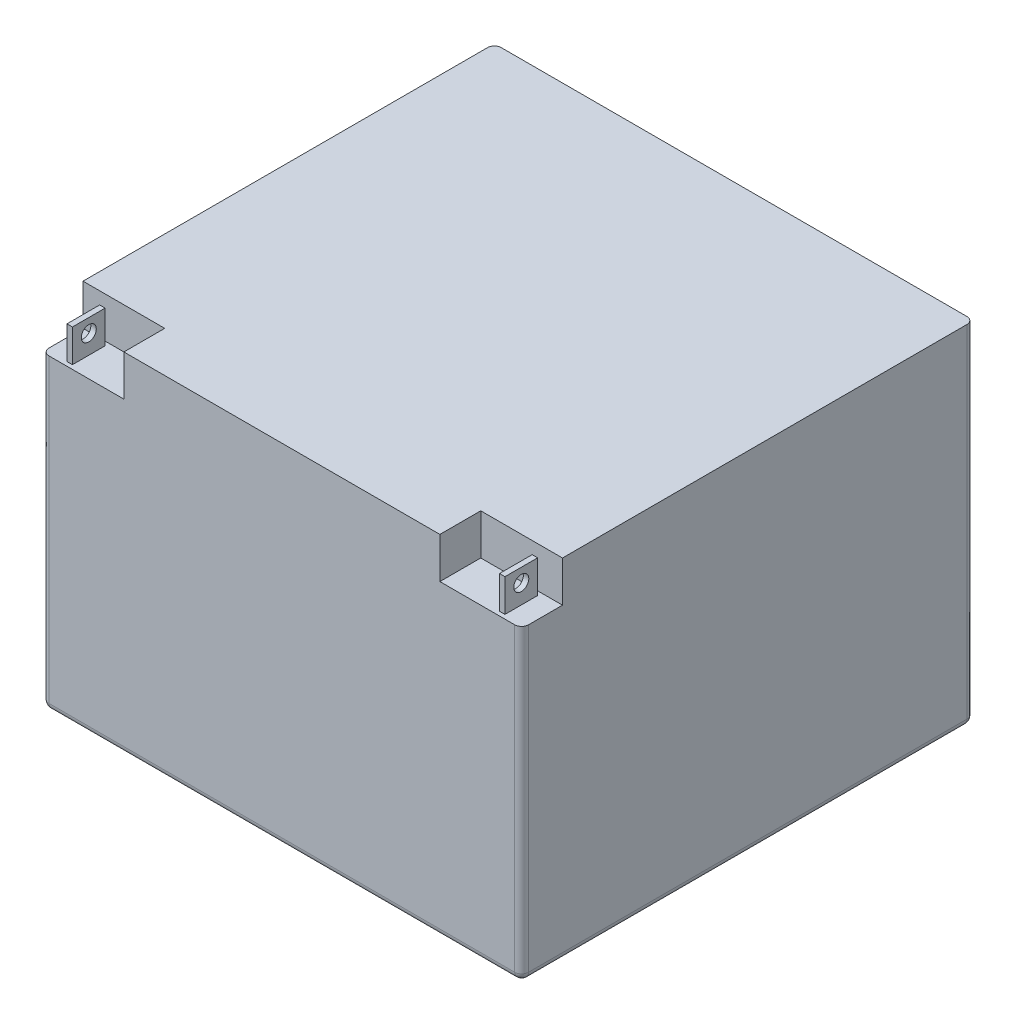
from build123d import *

# Parameters (mm, degrees)
SKETCH1_W           = 176
SKETCH1_H           = 166
BOSS_EXTRUDE1_DEPTH = 128
SKETCH3_W           = 30
SKETCH3_H           = 15
CUT_EXTRUDE1_DEPTH  = 15
FILLET1_R           = 2.54
SKETCH4_W           = 12
SKETCH4_H           = 12
SKETCH4_R           = 2.75
BOSS_EXTRUDE2_DEPTH = 2


with BuildPart() as part:
    # Sketch1 → Boss-Extrude1 (new body)
    with BuildSketch(Plane(origin=(0, 0, 0), x_dir=(1, 0, 0), z_dir=(0, 1, 0))):
        with Locations((0, 83)):
            Rectangle(SKETCH1_W, SKETCH1_H)
    extrude(amount=BOSS_EXTRUDE1_DEPTH)

    # Sketch3 → Cut-Extrude1 (cut)
    with BuildSketch(Plane(origin=(0, 128, 0), x_dir=(1, 0, 0), z_dir=(0, 1, 0))):
        with Locations((73, 7.5)):
            Rectangle(SKETCH3_W, SKETCH3_H)
    cut_extrude1 = extrude(amount=-CUT_EXTRUDE1_DEPTH, mode=Mode.SUBTRACT)

    # Fillet1
    fillet1_edges = [part.edges().sort_by_distance(p)[0] for p in [
        (0, 0, -166),
        (-88, 0, -83),
        (0, 0, 0),
        (88, 0, -83),
        (88, 64, -166),
        (-88, 64, -166),
        (-88, 64, 0),
        (88, 56.5, 0),
    ]]
    fillet(fillet1_edges, radius=FILLET1_R)

    # Sketch4 → Boss-Extrude2 (add)
    with BuildSketch(Plane(origin=(80.38, 0, 0), x_dir=(0, 0, -1), z_dir=(1, 0, 0))):
        with Locations((7.5, 119)):
            Rectangle(SKETCH4_W, SKETCH4_H)
        with Locations((7.5, 120)):
            Circle(SKETCH4_R, mode=Mode.SUBTRACT)
    boss_extrude2 = extrude(amount=-BOSS_EXTRUDE2_DEPTH)

    # Mirror2: Cut-Extrude1, Boss-Extrude2 across plane
    add(cut_extrude1.mirror(Plane(origin=(0, 0, 0), x_dir=(0, 0, 1), z_dir=(1, 0, 0))), mode=Mode.SUBTRACT)
    add(boss_extrude2.mirror(Plane(origin=(0, 0, 0), x_dir=(0, 0, 1), z_dir=(1, 0, 0))))


solid = part.part
